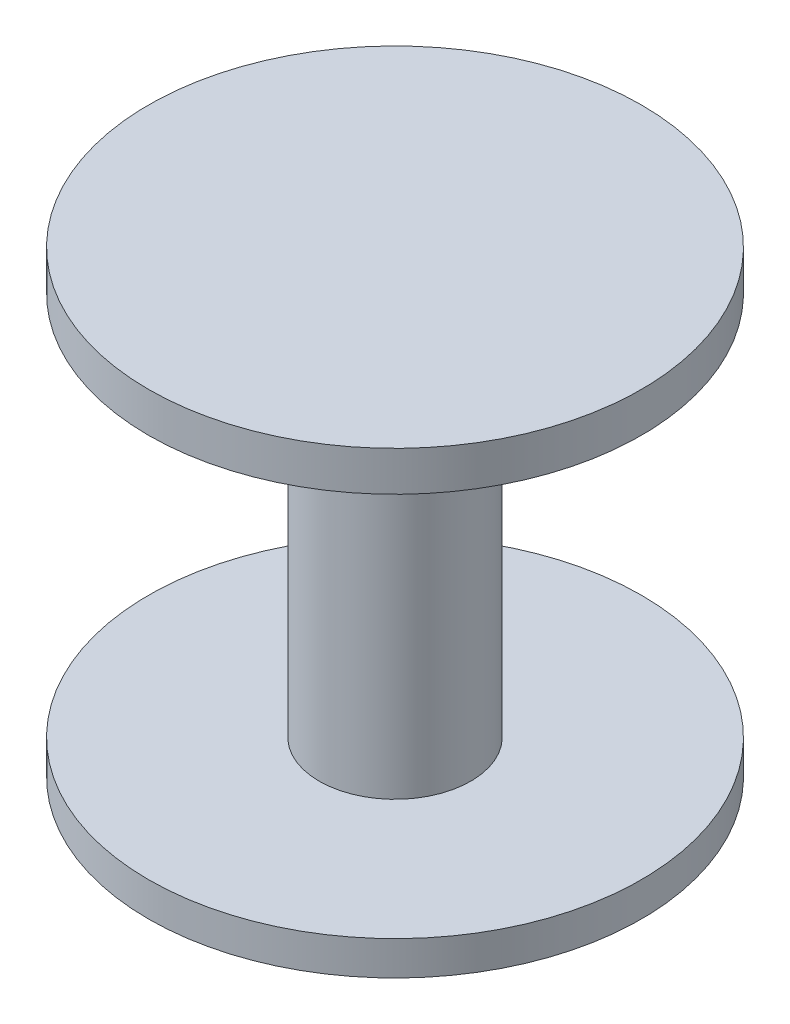
from build123d import *

# Parameters (mm, degrees)
SKETCH_1_R      = 6.5
EXTRUDE_1_DEPTH = 0.9
SKETCH_2_R      = 2
EXTRUDE_2_DEPTH = 10.15
SKETCH_3_R      = 6.5
EXTRUDE_3_DEPTH = 1.05
M2X0_4_1_D      = 1.6
M2X0_4_1_DEPTH  = 5.2
M2X0_4_1_TIP    = 0.480688495


with BuildPart() as part:
    # 草图1 → 凸台-拉伸1 (new body)
    with BuildSketch(Plane(origin=(0, 0, 0), x_dir=(1, 0, 0), z_dir=(0, 1, 0))):
        with Locations(Location((0, 0, 0), (0, 0, 270))):
            Circle(SKETCH_1_R)
    extrude(amount=EXTRUDE_1_DEPTH)

    # 草图2 → 凸台-拉伸2 (add)
    with BuildSketch(Plane(origin=(0, 0.9, 0), x_dir=(1, 0, 0), z_dir=(0, 1, 0))):
        with Locations(Location((0, 0, 0), (0, 0, 270))):
            Circle(SKETCH_2_R)
    extrude(amount=EXTRUDE_2_DEPTH)

    # 草图3 → 凸台-拉伸3 (add)
    with BuildSketch(Plane(origin=(0, 11.05, 0), x_dir=(1, 0, 0), z_dir=(0, 1, 0))):
        with Locations(Location((0, 0, 0), (0, 0, 270))):
            Circle(SKETCH_3_R)
    extrude(amount=EXTRUDE_3_DEPTH)

    # M2x0.4 螺纹孔1
    with Locations(Plane(origin=(0, 0, 0), x_dir=(0, 0, -1), z_dir=(0, -1, 0))):
        with Locations((0, 0)):
            Hole(M2X0_4_1_D / 2, depth=M2X0_4_1_DEPTH)
            with Locations((0, 0, -(M2X0_4_1_DEPTH + M2X0_4_1_TIP / 2))):  # 118° drill point
                Cone(0, M2X0_4_1_D / 2, M2X0_4_1_TIP, mode=Mode.SUBTRACT)


solid = part.part
